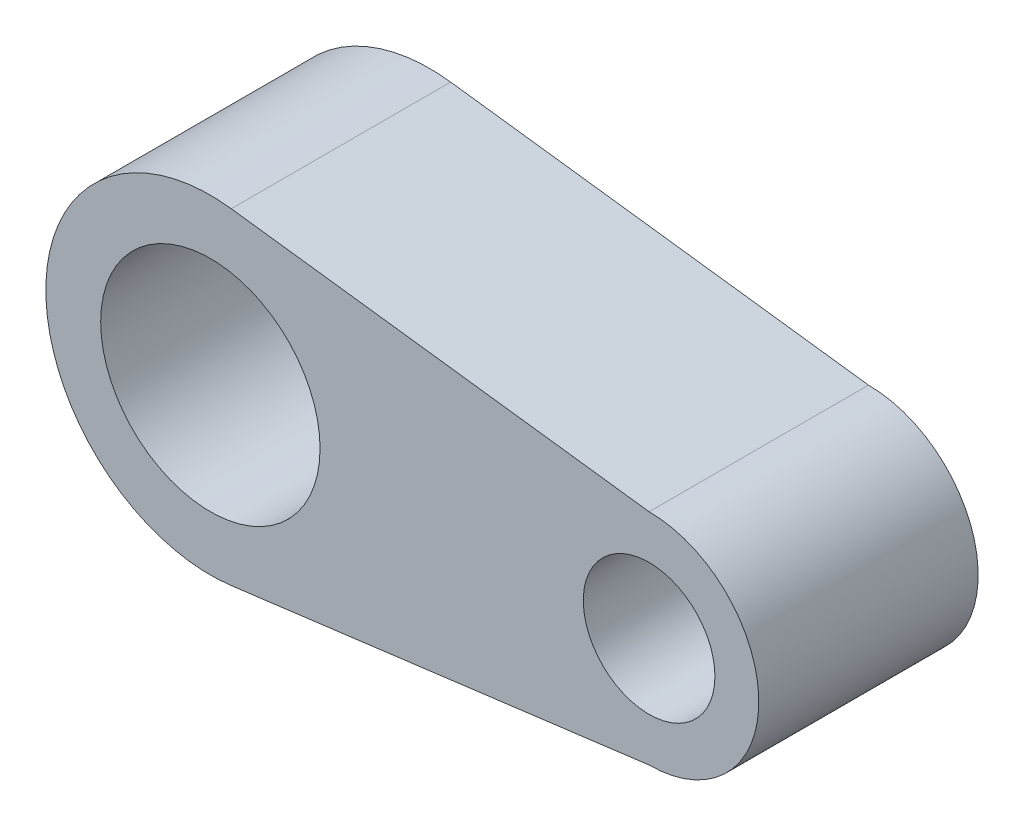
from build123d import *

# Parameters (mm, degrees)
SKETCH1_R           = 5
SKETCH1_R_2         = 3
BOSS_EXTRUDE1_DEPTH = 10


with BuildPart() as part:
    # Sketch1 → Boss-Extrude1 (new body)
    with BuildSketch(Plane.XY):
        with BuildLine():
            ThreePointArc((0.952688438, 7.439246248), (-7.5, 0), (0.952688438, -7.439246248))
            Line((0.952688438, -7.439246248), (20, -5))
            ThreePointArc((20, -5), (25, 0), (20, 5))
            Line((20, 5), (0.952688438, 7.439246248))
        make_face()
        Circle(SKETCH1_R, mode=Mode.SUBTRACT)
        with Locations((20, 0)):
            Circle(SKETCH1_R_2, mode=Mode.SUBTRACT)
    extrude(amount=BOSS_EXTRUDE1_DEPTH)


solid = part.part
